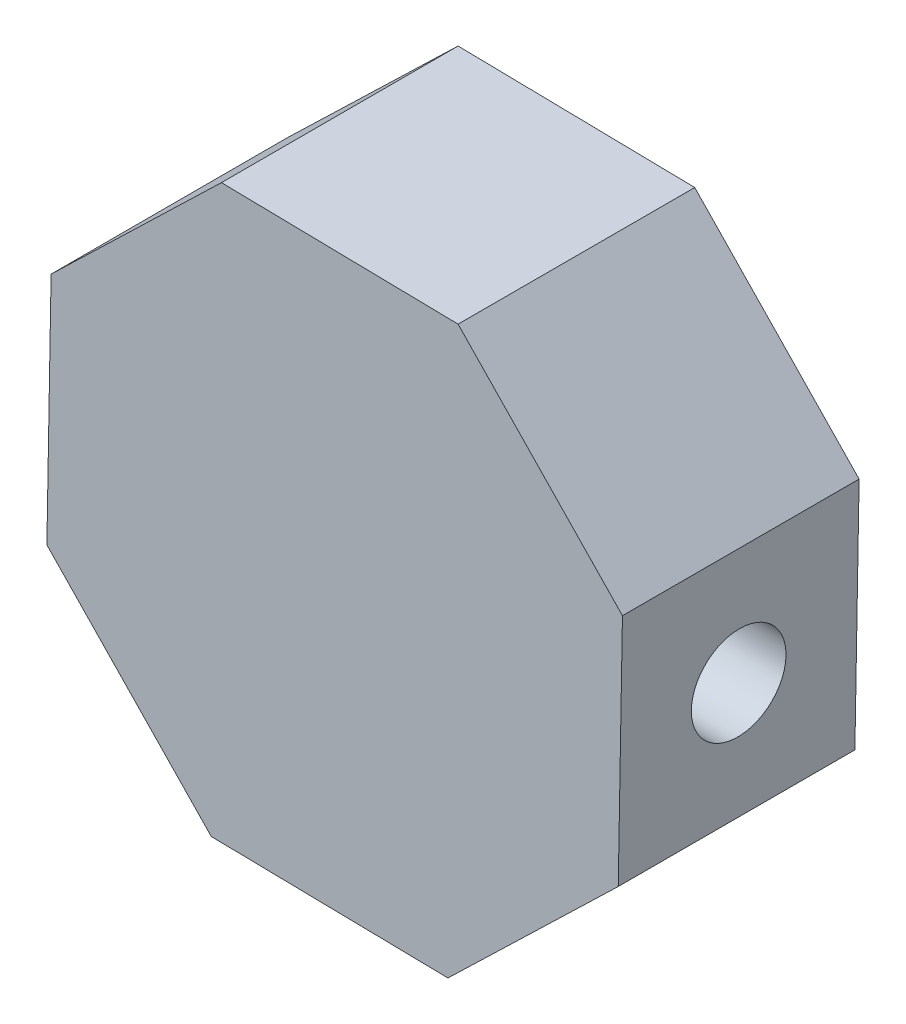
from build123d import *

# Parameters (mm, degrees)
BOSS_EXTRUDE2_DEPTH = 12.7
CUT_EXTRUDE3_DEPTH  = 12.7
SKETCH7_R           = 3.175
CUT_EXTRUDE5_DEPTH  = 2.54


with BuildPart() as part:
    # Sketch5 → Boss-Extrude2 (new body)
    with BuildSketch(Plane.XY):
        Polygon((17.316446729, -7.015021533), (17.542582687, 5.684978467), (8.722228835, 14.825136857), (-3.977771165, 15.051272815), (-13.117929555, 6.230918963), (-13.344065513, -6.469081037), (-4.523711662, -15.609239427), (8.176288338, -15.835375385), align=None)
    extrude(amount=BOSS_EXTRUDE2_DEPTH)

    # Sketch6 → Cut-Extrude3 (cut)
    with BuildSketch(Plane(origin=(17.435827988, -0.310462021, 0), x_dir=(0, 0, -1), z_dir=(0.9998415112072249, -0.017803158900963578, 0))):
        with BuildLine():
            ThreePointArc((-8.14590888, 1.441577842), (-8.89, -0.354615715), (-8.14590888, -2.150809272))
            Line((-8.14590888, -2.150809272), (-6.35, -0.354615715))
            Line((-6.35, -0.354615715), (-8.14590888, 1.441577842))
        make_face()
        with BuildLine():
            Line((-6.35, -0.354615715), (-8.14590888, -2.150809272))
            ThreePointArc((-8.14590888, -2.150809272), (-6.35, -2.894615715), (-4.55409112, -2.150809272))
            Line((-4.55409112, -2.150809272), (-6.35, -0.354615715))
        make_face()
        with BuildLine():
            Line((-8.14590888, 1.441577842), (-6.35, -0.354615715))
            Line((-6.35, -0.354615715), (-4.55409112, 1.441577842))
            ThreePointArc((-4.55409112, 1.441577842), (-6.35, 2.185384285), (-8.14590888, 1.441577842))
        make_face()
        with BuildLine():
            Line((-4.55409112, 1.441577842), (-6.35, -0.354615715))
            Line((-6.35, -0.354615715), (-4.55409112, -2.150809272))
            ThreePointArc((-4.55409112, -2.150809272), (-4.003384506, -1.326724619), (-3.81, -0.354615715))
            ThreePointArc((-3.81, -0.354615715), (-4.003384506, 0.617493189), (-4.55409112, 1.441577842))
        make_face()
    extrude(amount=-CUT_EXTRUDE3_DEPTH, mode=Mode.SUBTRACT)

    # Sketch7 → Cut-Extrude5 (cut)
    with BuildSketch(Plane(origin=(0, 0, 0), x_dir=(-1, 0, 0), z_dir=(0, 0, -1))):
        with Locations((-2.099258587, -0.392051285)):
            Circle(SKETCH7_R)
    extrude(amount=-CUT_EXTRUDE5_DEPTH, mode=Mode.SUBTRACT)


solid = part.part
